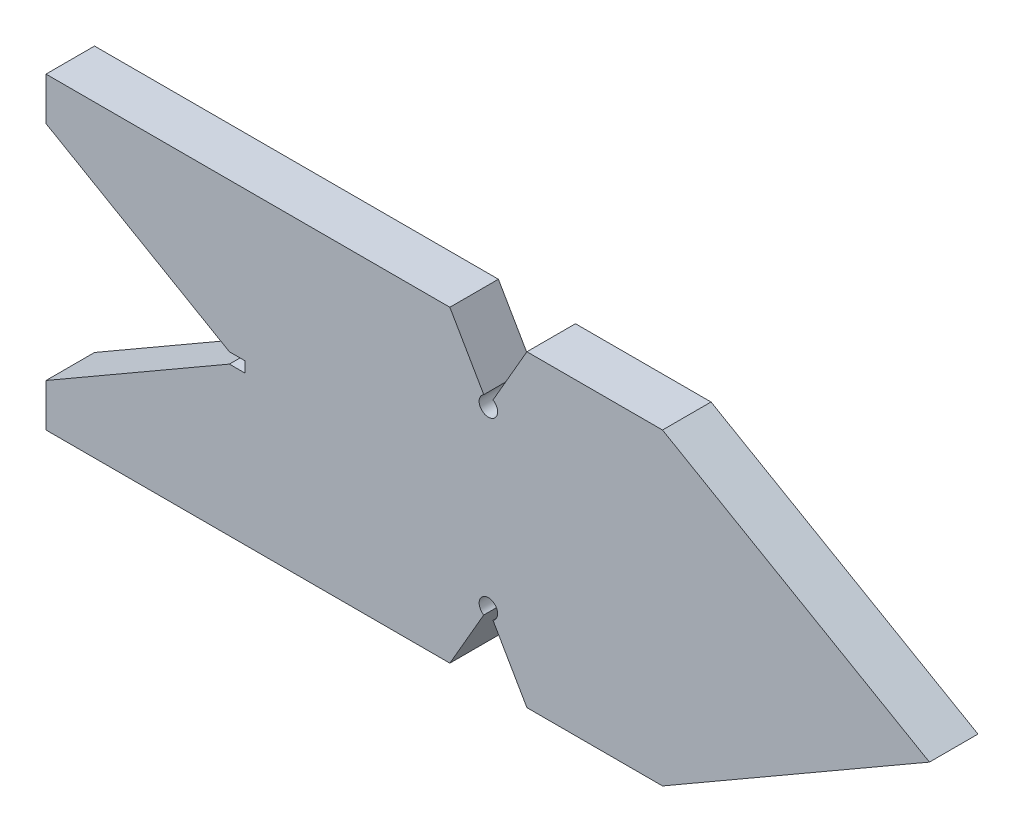
from build123d import *

# Parameters (mm, degrees)
BOSS_EXTRUDE1_DEPTH = 4
CUT_EXTRUDE1_DEPTH  = 1


with BuildPart() as part:
    # Sketch1 → Boss-Extrude1 (new body)
    with BuildSketch(Plane(origin=(0, 0, 0), x_dir=(-1, 0, 0), z_dir=(0, 0, -1))):
        with BuildLine():
            Line((-33.277650511, 0), (0, 0))
            Line((0, 0), (0, 3.534564477))
            Line((0, 3.534564477), (-15.113, 12.260059095))
            Line((-15.113, 12.260059095), (-16.383, 12.260059095))
            Line((-16.383, 12.260059095), (-16.383, 13.139940905))
            Line((-16.383, 13.139940905), (-15.113, 13.139940905))
            Line((-15.113, 13.139940905), (0, 21.865435523))
            Line((0, 21.865435523), (0, 25.4))
            Line((0, 25.4), (-33.277650511, 25.4))
            Line((-33.277650511, 25.4), (-36.071650511, 20.560650044))
            ThreePointArc((-36.071650511, 20.560650044), (-36.452650511, 19.138738686), (-36.833650511, 20.560650044))
            Line((-36.833650511, 20.560650044), (-39.627650511, 25.4))
            Line((-39.627650511, 25.4), (-50.8, 25.4))
            Line((-50.8, 25.4), (-72.797045256, 12.7))
            Line((-72.797045256, 12.7), (-50.8, 0))
            Line((-50.8, 0), (-39.627650511, 0))
            Line((-39.627650511, 0), (-36.833650511, 4.839349956))
            ThreePointArc((-36.833650511, 4.839349956), (-36.452650511, 6.261261314), (-36.071650511, 4.839349956))
            Line((-36.071650511, 4.839349956), (-33.277650511, 0))
        make_face()
    extrude(amount=-BOSS_EXTRUDE1_DEPTH)

    # Sketch2 → Cut-Extrude1 (cut)
    # profile 1 of 2: a face of its own
    with BuildSketch(Plane(origin=(0, 0, 0), x_dir=(-1, 0, 0), z_dir=(0, 0, -1))):
        with BuildLine():
            Line((-38.015292109, 15.252736347), (-37.77340509, 15.062732341))
            Line((-37.77340509, 15.062732341), (-38.698184738, 13.648569681))
            add(Edge.make_bspline(
                [(-38.698184738, 13.648569681), (-38.636614461, 13.658383541), (-38.516514674, 13.677526586), (-38.394948775, 13.680684532), (-38.33570477, 13.682223527)],
                knots=[0, 0, 0, 0, 1.025318673, 2, 2, 2, 2], degree=3))
            add(Edge.make_bspline(
                [(-38.33570477, 13.682223527), (-38.300132273, 13.681267415), (-38.230108873, 13.679385338), (-38.127302071, 13.664901487), (-38.028513135, 13.642076375), (-37.934151523, 13.608804119), (-37.843878541, 13.566301765), (-37.757176145, 13.515362895), (-37.675674134, 13.453357214), (-37.598322955, 13.384092258), (-37.528095858, 13.307375274), (-37.465919802, 13.225973937), (-37.413693011, 13.139973056), (-37.371319089, 13.04941619), (-37.33841421, 12.954442931), (-37.314426565, 12.855174791), (-37.300246972, 12.75154332), (-37.298321482, 12.681065145), (-37.297343391, 12.645264392)],
                knots=[0, 0, 0, 0, 1.04369286, 2.054478336, 3.041073146, 4.015093852, 4.984733326, 5.965804835, 6.960378782, 7.985147595, 9.009457201, 10.008161701, 10.986880575, 11.956520048, 12.937015923, 13.931873656, 14.949455224, 16, 16, 16, 16], degree=3))
            add(Edge.make_bspline(
                [(-37.297343391, 12.645264392), (-37.298766496, 12.596284688), (-37.30156683, 12.499904222), (-37.329470626, 12.359527516), (-37.372830271, 12.225795001), (-37.434807799, 12.100841829), (-37.511790182, 11.98483926), (-37.605667775, 11.882053794), (-37.713111263, 11.790383757), (-37.834598061, 11.713727138), (-37.965341025, 11.651124087), (-38.102693023, 11.606158845), (-38.245320169, 11.578475375), (-38.342124777, 11.575004772), (-38.391093391, 11.573249168)],
                knots=[0, 0, 0, 0, 1.031375318, 2.029502543, 3.004789286, 3.987476834, 4.960371455, 5.9300674, 6.912260825, 7.929083631, 8.949397511, 9.960523116, 10.96833055, 12, 12, 12, 12], degree=3))
            add(Edge.make_bspline(
                [(-38.391093391, 11.573249168), (-38.438190092, 11.574777374), (-38.53148041, 11.577804482), (-38.668713204, 11.60477042), (-38.800576222, 11.648477522), (-38.926145603, 11.708691801), (-39.042466216, 11.784749684), (-39.146531852, 11.876311963), (-39.237823627, 11.981421428), (-39.313798247, 12.100061775), (-39.374056979, 12.227551733), (-39.419246905, 12.360488889), (-39.445643148, 12.498388871), (-39.449331705, 12.59187001), (-39.451189545, 12.638954296)],
                knots=[0, 0, 0, 0, 1.012016664, 2.004627821, 2.994792927, 3.992885782, 4.990978636, 5.973936114, 6.964471063, 7.975201453, 8.993600317, 9.990122807, 10.98767138, 12, 12, 12, 12], degree=3))
            add(Edge.make_bspline(
                [(-39.451189545, 12.638954296), (-39.4500081, 12.674998879), (-39.447595815, 12.748595031), (-39.430752425, 12.860059059), (-39.40368763, 12.974110141), (-39.373377384, 13.070864335), (-39.341351774, 13.150125857), (-39.314699234, 13.214029347), (-39.281525238, 13.27979042), (-39.246151857, 13.349664056), (-39.205394988, 13.421849489), (-39.161079339, 13.497553159), (-39.111979688, 13.575571086), (-39.077559525, 13.628515282), (-39.059963584, 13.655580899)],
                knots=[0, 0, 0, 0, 1.173818275, 2.396712641, 3.66331629, 4.989737886, 5.693666774, 6.447286557, 7.243889047, 8.091586357, 8.998013824, 9.943181721, 10.948533338, 12, 12, 12, 12], degree=3))
            Line((-39.059963584, 13.655580899), (-38.015292109, 15.252736347))
        make_face()
        with BuildLine():
            add(Edge.make_bspline(
                [(-38.401610218, 13.323249168), (-38.428272463, 13.322471124), (-38.480351573, 13.320951379), (-38.556758987, 13.312126127), (-38.629072239, 13.295507061), (-38.698249372, 13.274340729), (-38.762997075, 13.24523767), (-38.823785915, 13.209885871), (-38.880850967, 13.168264693), (-38.933594519, 13.120963782), (-38.981414182, 13.069175749), (-39.022595313, 13.013706226), (-39.058117713, 12.955892023), (-39.086999532, 12.895250081), (-39.109489608, 12.831803582), (-39.125757859, 12.765844332), (-39.13481161, 12.696930026), (-39.136317841, 12.650197523), (-39.137086981, 12.626334104)],
                knots=[0, 0, 0, 0, 1.129588631, 2.206414736, 3.251139165, 4.268635594, 5.265702196, 6.250456724, 7.242448911, 8.251968645, 9.246821453, 10.222880186, 11.173611482, 12.116736599, 13.062300278, 14.020270554, 14.989073742, 16, 16, 16, 16], degree=3))
            add(Edge.make_bspline(
                [(-39.137086981, 12.626334104), (-39.13646062, 12.602684124), (-39.135232418, 12.556310034), (-39.124080098, 12.487970855), (-39.107045016, 12.422205946), (-39.08170462, 12.359354347), (-39.051477732, 12.298458029), (-39.011572408, 12.241722744), (-38.967355622, 12.185702674), (-38.914501688, 12.134701202), (-38.857778325, 12.087244578), (-38.797177123, 12.045764325), (-38.734017163, 12.010278151), (-38.667445741, 11.982467054), (-38.598407357, 11.959642767), (-38.526326803, 11.943581288), (-38.451153947, 11.934500762), (-38.400232009, 11.932992568), (-38.374266468, 11.932223527)],
                knots=[0, 0, 0, 0, 0.989467248, 1.94019797, 2.891935182, 3.827694429, 4.772920941, 5.730924762, 6.725747692, 7.756678648, 8.79901574, 9.819492441, 10.826891316, 11.826466727, 12.835195252, 13.867842842, 14.912794438, 16, 16, 16, 16], degree=3))
            add(Edge.make_bspline(
                [(-38.374266468, 11.932223527), (-38.34830097, 11.932992628), (-38.297379115, 11.93450094), (-38.222205655, 11.943580609), (-38.150127336, 11.959645257), (-38.081080828, 11.982458027), (-38.014539397, 12.010311637), (-37.951434675, 12.045543557), (-37.891406582, 12.087499674), (-37.834645982, 12.134620103), (-37.782012044, 12.185992955), (-37.736734765, 12.241222677), (-37.698051532, 12.298916572), (-37.666617345, 12.359114462), (-37.641556053, 12.42224395), (-37.624434586, 12.487960674), (-37.613305297, 12.5563127), (-37.612073931, 12.602685024), (-37.611445956, 12.626334104)],
                knots=[0, 0, 0, 0, 1.087397944, 2.132534446, 3.165364764, 4.174271784, 5.174024072, 6.181601208, 7.194203697, 8.236725232, 9.267838612, 10.269026844, 11.221737037, 12.171628256, 13.107553087, 14.05945871, 15.010357665, 16, 16, 16, 16], degree=3))
            add(Edge.make_bspline(
                [(-37.611445956, 12.626334104), (-37.611996249, 12.650228655), (-37.613076295, 12.697125887), (-37.625292243, 12.765813506), (-37.642234617, 12.832138712), (-37.667817648, 12.895684661), (-37.701054193, 12.956200588), (-37.7415376, 13.013992189), (-37.78837017, 13.069502536), (-37.84246771, 13.121065345), (-37.901357944, 13.168212423), (-37.963973529, 13.209831979), (-38.029481503, 13.244956956), (-38.097815445, 13.274264058), (-38.169758328, 13.295413532), (-38.244148667, 13.312066775), (-38.32193791, 13.320928793), (-38.374714518, 13.322465858), (-38.401610218, 13.323249168)],
                knots=[0, 0, 0, 0, 0.978206639, 1.919901502, 2.851605144, 3.780102724, 4.718870031, 5.675451981, 6.667674623, 7.690630536, 8.733308323, 9.756129687, 10.767539656, 11.776269907, 12.797430371, 13.836405707, 14.897401972, 16, 16, 16, 16], degree=3))
        make_face(mode=Mode.SUBTRACT)
    # profile 2 of 2: a face of its own
    with BuildSketch(Plane(origin=(0, 0, 0), x_dir=(-1, 0, 0), z_dir=(0, 0, -1))):
        with BuildLine():
            add(Edge.make_bspline(
                [(-36.938369033, 13.411590514), (-36.938041014, 13.467687902), (-36.937403834, 13.576657886), (-36.930315413, 13.735442528), (-36.918540071, 13.884402817), (-36.902402698, 14.023545883), (-36.882764718, 14.152907648), (-36.856549231, 14.272142405), (-36.826736429, 14.381802011), (-36.792183983, 14.48224406), (-36.753196194, 14.574821763), (-36.710761933, 14.661246964), (-36.663197139, 14.741388897), (-36.613220226, 14.816526687), (-36.558808154, 14.885430382), (-36.501509364, 14.949073044), (-36.439087488, 15.005983795), (-36.373664479, 15.057830097), (-36.304648015, 15.103279569), (-36.234005349, 15.143312307), (-36.161250243, 15.177512175), (-36.08618406, 15.204402611), (-36.009481502, 15.226613457), (-35.930874435, 15.241802405), (-35.850233071, 15.251359314), (-35.795801637, 15.252272981), (-35.768196757, 15.252736347)],
                knots=[0, 0, 0, 0, 1.646270934, 3.197905019, 4.663502075, 6.030701355, 7.308322542, 8.50163776, 9.611534131, 10.641858119, 11.616356847, 12.558055219, 13.465016945, 14.349605745, 15.204443733, 16.039544428, 16.859896111, 17.680448484, 18.487036065, 19.28249412, 20.06191084, 20.843045899, 21.620316918, 22.403196591, 23.190181807, 24, 24, 24, 24], degree=3))
            add(Edge.make_bspline(
                [(-35.768196757, 15.252736347), (-35.740361278, 15.252248532), (-35.685005269, 15.251278421), (-35.603164894, 15.241954479), (-35.523215213, 15.226483356), (-35.445497074, 15.204562381), (-35.369372087, 15.177366705), (-35.29543568, 15.143279587), (-35.223228598, 15.10360072), (-35.153898311, 15.056976843), (-35.086683695, 15.004994567), (-35.023235732, 14.946231898), (-34.963548646, 14.881282178), (-34.906873341, 14.810840315), (-34.854817744, 14.73355523), (-34.805244312, 14.65077112), (-34.760872276, 14.561040255), (-34.7181376, 14.465859787), (-34.681250614, 14.362596129), (-34.647984368, 14.251831368), (-34.6211054, 14.132257181), (-34.598716128, 14.004500936), (-34.581371232, 13.868093453), (-34.568738589, 13.723327137), (-34.562065504, 13.570106746), (-34.560808803, 13.465348897), (-34.560163904, 13.411590514)],
                knots=[0, 0, 0, 0, 0.810914788, 1.612654377, 2.396697861, 3.181598691, 3.963628158, 4.749916497, 5.551656086, 6.361998678, 7.18212741, 8.025565596, 8.878627764, 9.750805457, 10.657531673, 11.591944965, 12.560506719, 13.57287815, 14.630710178, 15.753379473, 16.941251878, 18.199788006, 19.531962791, 20.947069417, 22.433333509, 24, 24, 24, 24], degree=3))
            add(Edge.make_bspline(
                [(-34.560163904, 13.411590514), (-34.560815489, 13.358066606), (-34.562085075, 13.253777454), (-34.568663782, 13.101246479), (-34.581622413, 12.957248436), (-34.597832401, 12.821437973), (-34.620283364, 12.694380354), (-34.64788853, 12.575635906), (-34.678538853, 12.464691834), (-34.716373647, 12.362457023), (-34.757784358, 12.2675053), (-34.802839554, 12.178838151), (-34.85110938, 12.095671859), (-34.903698125, 12.018672112), (-34.959751538, 11.947293455), (-35.020469327, 11.882795832), (-35.084139912, 11.82362516), (-35.151552328, 11.770973533), (-35.221963879, 11.724888728), (-35.293922956, 11.683674878), (-35.368706339, 11.650442183), (-35.444619292, 11.621907142), (-35.522747658, 11.60010669), (-35.602994049, 11.585032834), (-35.684950285, 11.574460986), (-35.74035185, 11.573654506), (-35.768196757, 11.573249168)],
                knots=[0, 0, 0, 0, 1.561518951, 3.042555995, 4.452378317, 5.7783523, 7.031515105, 8.214008947, 9.334062868, 10.386615937, 11.391082383, 12.354592575, 13.286541444, 14.194233754, 15.072674879, 15.931287219, 16.775624067, 17.606195743, 18.42308326, 19.229000347, 20.022332153, 20.807536673, 21.593273796, 22.3848459, 23.188221202, 24, 24, 24, 24], degree=3))
            add(Edge.make_bspline(
                [(-35.768196757, 11.573249168), (-35.795800871, 11.573715523), (-35.850230796, 11.574635085), (-35.930883221, 11.584148817), (-36.009165665, 11.59944432), (-36.085464419, 11.620860924), (-36.160170934, 11.64707576), (-36.23226722, 11.681229444), (-36.302554904, 11.720563513), (-36.37084646, 11.765358934), (-36.435858621, 11.816680618), (-36.497957226, 11.873444906), (-36.555582245, 11.937068318), (-36.609216341, 12.006546241), (-36.660190429, 12.081239483), (-36.707079803, 12.162167856), (-36.750450657, 12.249010467), (-36.790094147, 12.342328377), (-36.825242811, 12.443483305), (-36.856290519, 12.553632484), (-36.880804676, 12.67374812), (-36.901787632, 12.802865487), (-36.918712015, 12.941539417), (-36.93026634, 13.089845195), (-36.937407655, 13.247690404), (-36.938042726, 13.355960179), (-36.938369033, 13.411590514)],
                knots=[0, 0, 0, 0, 0.810891512, 1.598919785, 2.382837074, 3.152667961, 3.926044502, 4.706494248, 5.493654104, 6.291793342, 7.103789334, 7.925228297, 8.761435821, 9.622817696, 10.50288917, 11.416980706, 12.369136599, 13.353924996, 14.394355917, 15.514179734, 16.714354668, 17.994756427, 19.357759367, 20.818452758, 22.365282078, 24, 24, 24, 24], degree=3))
        make_face()
        with BuildLine():
            add(Edge.make_bspline(
                [(-36.624266468, 13.412992758), (-36.624147021, 13.366244059), (-36.623915198, 13.275514014), (-36.617858997, 13.143670753), (-36.609608765, 13.020700424), (-36.598967468, 12.906446888), (-36.58316452, 12.801296875), (-36.565457732, 12.704527192), (-36.543909642, 12.616649955), (-36.518414624, 12.537062144), (-36.489375528, 12.464413076), (-36.457669664, 12.396811861), (-36.423608941, 12.333459924), (-36.38548979, 12.274926316), (-36.343974727, 12.221020152), (-36.300001468, 12.17078732), (-36.251928884, 12.125990338), (-36.185425141, 12.072263483), (-36.097628667, 12.01674435), (-35.987008212, 11.96839826), (-35.873339761, 11.938015803), (-35.796188511, 11.934152047), (-35.75767993, 11.932223527)],
                knots=[0, 0, 0, 0, 1.459021318, 2.831673884, 4.118529203, 5.306027144, 6.411944654, 7.436330062, 8.375795394, 9.233974572, 10.042671642, 10.816086306, 11.563610507, 12.285937304, 12.993564865, 13.685989202, 14.367179055, 15.041617293, 16.353048772, 17.594441528, 18.799311195, 20, 20, 20, 20], degree=3))
            add(Edge.make_bspline(
                [(-35.75767993, 11.932223527), (-35.718922258, 11.933821308), (-35.641486935, 11.937013571), (-35.52835314, 11.967812308), (-35.41852287, 12.014281847), (-35.33245093, 12.069229353), (-35.266968386, 12.121557682), (-35.220051396, 12.166172331), (-35.176989348, 12.216128198), (-35.136147273, 12.270027494), (-35.098688197, 12.328899978), (-35.064625059, 12.392462553), (-35.033541712, 12.460891731), (-35.015832666, 12.50866147), (-35.006778488, 12.533084905)],
                knots=[0, 0, 0, 0, 1.353760809, 2.704726607, 4.075137775, 5.516104923, 6.260822281, 7.007110065, 7.778089737, 8.566572457, 9.372053459, 10.217411131, 11.088608312, 12, 12, 12, 12], degree=3))
            add(Edge.make_bspline(
                [(-35.006778488, 12.533084905), (-34.99622672, 12.564314645), (-34.974802106, 12.627724409), (-34.947190332, 12.726088061), (-34.925444933, 12.829290825), (-34.905881567, 12.936715942), (-34.892528511, 13.049155643), (-34.881780698, 13.166262027), (-34.875450011, 13.288123389), (-34.87466526, 13.37091838), (-34.874266468, 13.412992758)],
                knots=[0, 0, 0, 0, 0.884706709, 1.796334032, 2.740027952, 3.714592787, 4.726048262, 5.777819803, 6.87074269, 8, 8, 8, 8], degree=3))
            add(Edge.make_bspline(
                [(-34.874266468, 13.412992758), (-34.874816658, 13.45506033), (-34.875892945, 13.537353495), (-34.880006933, 13.657871676), (-34.890630508, 13.772339437), (-34.902429626, 13.881249909), (-34.919826848, 13.984000212), (-34.938584654, 14.081450517), (-34.963785867, 14.172393542), (-34.990705642, 14.258253124), (-35.021516037, 14.338053778), (-35.055431771, 14.412167565), (-35.09165353, 14.480952289), (-35.130995771, 14.544219231), (-35.172991454, 14.602251774), (-35.218749003, 14.653886368), (-35.266453376, 14.700723337), (-35.333270562, 14.754185906), (-35.420744851, 14.808697601), (-35.529590499, 14.858863361), (-35.642861143, 14.887671654), (-35.719434597, 14.891733341), (-35.75767993, 14.893761988)],
                knots=[0, 0, 0, 0, 1.31362396, 2.569729283, 3.763502607, 4.902122613, 5.988968491, 7.01645872, 7.998833611, 8.933434873, 9.825090667, 10.667526885, 11.477055099, 12.250526234, 12.991942729, 13.710640831, 14.402115721, 15.076753259, 16.378508321, 17.609869233, 18.806226677, 20, 20, 20, 20], degree=3))
            add(Edge.make_bspline(
                [(-35.75767993, 14.893761988), (-35.796390522, 14.891730542), (-35.873882228, 14.887663948), (-35.988330182, 14.858970694), (-36.098034534, 14.808957728), (-36.185277509, 14.754005356), (-36.252141295, 14.701667044), (-36.299223989, 14.65628059), (-36.343370161, 14.606634336), (-36.384037861, 14.552232421), (-36.422127144, 14.493767054), (-36.457108157, 14.430778289), (-36.488625486, 14.362946925), (-36.517710023, 14.290330489), (-36.543282811, 14.210749545), (-36.564376774, 14.122980551), (-36.583863827, 14.02651866), (-36.597659096, 13.920799152), (-36.609922852, 13.806516998), (-36.6178042, 13.68323968), (-36.623935457, 13.5511753), (-36.624153921, 13.459976141), (-36.624266468, 13.412992758)],
                knots=[0, 0, 0, 0, 1.207732386, 2.417664972, 3.655092373, 4.956220595, 5.625982001, 6.301752483, 6.994047911, 7.697131622, 8.419323945, 9.170223765, 9.943494443, 10.752040957, 11.610060368, 12.549350801, 13.567764191, 14.679664412, 15.874934091, 17.154273443, 18.533957287, 20, 20, 20, 20], degree=3))
        make_face(mode=Mode.SUBTRACT)
    extrude(amount=-CUT_EXTRUDE1_DEPTH, mode=Mode.SUBTRACT)


solid = part.part
